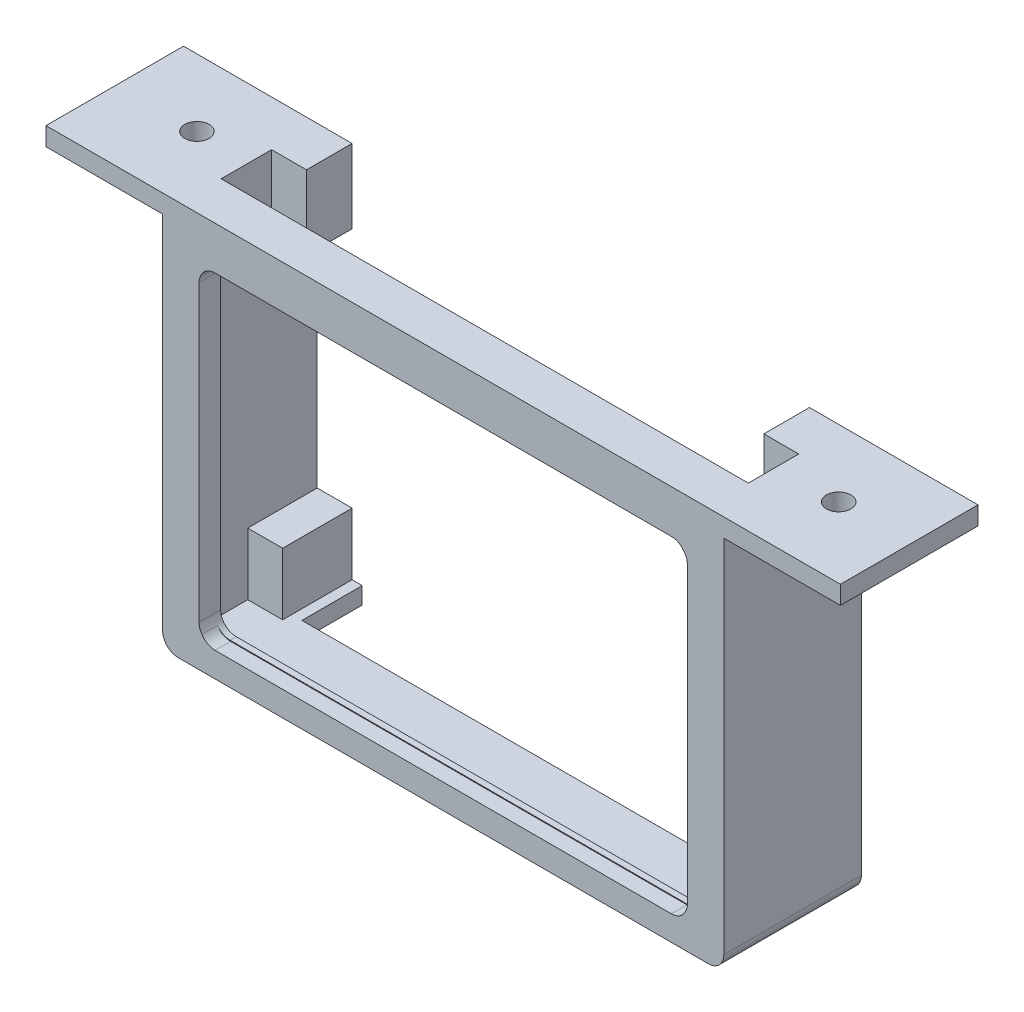
from build123d import *

# Parameters (mm, degrees)
SKETCH1_W            = 91.936945468
SKETCH1_H            = 61.663418702
SKETCH1_W_2          = 86.36
SKETCH1_H_2          = 56.134
BOSS_EXTRUDE1_DEPTH  = 20
SKETCH2_W            = 86.36
SKETCH2_H            = 56.134
BOSS_EXTRUDE3_DEPTH  = 1
SKETCH4_W            = 80
SKETCH4_H            = 53.28
CUT_EXTRUDE6_DEPTH   = 59.853162931
SKETCH5_W            = 155.947075919
SKETCH5_H            = 20
BOSS_EXTRUDE4_DEPTH  = 3
SKETCH8_W            = 12.917881336
SKETCH8_H            = 3
CUT_EXTRUDE7_DEPTH   = 88.335862802
SKETCH9_W            = 12.878183793
SKETCH9_H            = 3
CUT_EXTRUDE8_DEPTH   = 88.300413605
SKETCH10_R           = 2
CUT_EXTRUDE9_DEPTH   = 94.894510599
SKETCH10_3_R         = 2
CUT_EXTRUDE10_DEPTH  = 94.894510599
SKETCH11_W           = 74.933585118
SKETCH11_H           = 15.731166257
CUT_EXTRUDE11_DEPTH  = 20
FILLET1_R            = 2.54
FILLET2_R            = 2.54
FILLET3_R            = 2.54
FILLET4_R            = 2.54
FILLET5_R            = 2.54
FILLET6_R            = 2.54
SKETCH14_W           = 5.713207441
SKETCH14_H           = 8.255
CUT_EXTRUDE12_DEPTH  = 91.021549452
SKETCH15_W           = 5.713207441
SKETCH15_H           = 8.255
CUT_EXTRUDE13_DEPTH  = 91.021549452
SKETCH16_W           = 7.476166257
SKETCH16_H           = 6.35
BOSS_EXTRUDE5_DEPTH  = 5.713207
SKETCH17_W           = 7.476166257
SKETCH17_H           = 6.35
BOSS_EXTRUDE6_DEPTH  = 5.713207441
SKETCH18_W           = 11.38
SKETCH18_H           = 10.16
BOSS_EXTRUDE7_DEPTH  = 5.713207441
SKETCH19_W           = 11.38
SKETCH19_H           = 10.16
BOSS_EXTRUDE8_DEPTH  = 5.713207441
SKETCH20_W           = 71.616945468
SKETCH20_H           = 9.886340198
CUT_EXTRUDE14_DEPTH  = 94.894510599
SKETCH23_W           = 130.15101079
SKETCH23_H           = 3
BOSS_EXTRUDE14_DEPTH = 2.54


with BuildPart() as part:
    # Sketch1 → Boss-Extrude1 (new body)
    with BuildSketch(Plane.XY):
        Rectangle(SKETCH1_W, SKETCH1_H)
        Rectangle(SKETCH1_W_2, SKETCH1_H_2, mode=Mode.SUBTRACT)
    extrude(amount=BOSS_EXTRUDE1_DEPTH)

    # Sketch2 → Boss-Extrude3 (add)
    with BuildSketch(Plane.XY.offset(20)):
        Rectangle(SKETCH2_W, SKETCH2_H)
    extrude(amount=-BOSS_EXTRUDE3_DEPTH)

    # Sketch4 → Cut-Extrude6 (cut, through all)
    with BuildSketch(Plane.XY.offset(20)):
        Rectangle(SKETCH4_W, SKETCH4_H)
    extrude(amount=-CUT_EXTRUDE6_DEPTH, mode=Mode.SUBTRACT)

    # Sketch5 → Boss-Extrude4 (add)
    with BuildSketch(Plane(origin=(0, 30.831709351, 0), x_dir=(1, 0, 0), z_dir=(0, 1, 0))):
        with Locations((0.019848772, -10)):
            Rectangle(SKETCH5_W, SKETCH5_H)
    extrude(amount=BOSS_EXTRUDE4_DEPTH)

    # Sketch8 → Cut-Extrude7 (cut, through all)
    with BuildSketch(Plane.XY.offset(20)):
        with Locations((71.534446063, 32.331709351)):
            Rectangle(SKETCH8_W, SKETCH8_H)
    extrude(amount=-CUT_EXTRUDE7_DEPTH, mode=Mode.SUBTRACT)

    # Sketch9 → Cut-Extrude8 (cut, through all)
    with BuildSketch(Plane.XY.offset(20)):
        with Locations((-71.514597291, 32.331709351)):
            Rectangle(SKETCH9_W, SKETCH9_H)
    extrude(amount=-CUT_EXTRUDE8_DEPTH, mode=Mode.SUBTRACT)

    # Sketch10 → Cut-Extrude9 (cut, through all)
    with BuildSketch(Plane(origin=(0, 33.831709351, 0), x_dir=(1, 0, 0), z_dir=(0, 1, 0))):
        with Locations(Location((53.249133704, -11, 0), (0, 0, 270))):
            Circle(SKETCH10_R)
    extrude(amount=-CUT_EXTRUDE9_DEPTH, mode=Mode.SUBTRACT)

    # Sketch10<3> → Cut-Extrude10 (cut, through all)
    with BuildSketch(Plane(origin=(0, 33.831709351, 0), x_dir=(1, 0, 0), z_dir=(0, 1, 0))):
        with Locations(Location((53.249133704, -11, 0), (0, 0, 270))):
            Circle(SKETCH10_3_R)
        with Locations(Location((-51.881510593, -11, 0), (0, 0, 270))):
            Circle(SKETCH10_3_R)
    extrude(amount=-CUT_EXTRUDE10_DEPTH, mode=Mode.SUBTRACT)

    # Sketch11 → Cut-Extrude11 (cut)
    with BuildSketch(Plane(origin=(0, 33.831709351, 0), x_dir=(1, 0, 0), z_dir=(0, 1, 0))):
        with Locations((0, -7.865583129)):
            Rectangle(SKETCH11_W, SKETCH11_H)
    extrude(amount=-CUT_EXTRUDE11_DEPTH, mode=Mode.SUBTRACT)

    # Fillet1
    fillet1_edges = [part.edges().sort_by_distance(p)[0] for p in [
        (40, 26.64, 19.5),
    ]]
    fillet(fillet1_edges, radius=FILLET1_R)

    # Fillet2
    fillet2_edges = [part.edges().sort_by_distance(p)[0] for p in [
        (-40, 26.64, 19.5),
    ]]
    fillet(fillet2_edges, radius=FILLET2_R)

    # Fillet3
    fillet3_edges = [part.edges().sort_by_distance(p)[0] for p in [
        (-40, -26.64, 19.5),
    ]]
    fillet(fillet3_edges, radius=FILLET3_R)

    # Fillet4
    fillet4_edges = [part.edges().sort_by_distance(p)[0] for p in [
        (40, -26.64, 19.5),
    ]]
    fillet(fillet4_edges, radius=FILLET4_R)

    # Fillet5
    fillet5_edges = [part.edges().sort_by_distance(p)[0] for p in [
        (-45.968472734, -30.831709351, 10),
    ]]
    fillet(fillet5_edges, radius=FILLET5_R)

    # Fillet6
    fillet6_edges = [part.edges().sort_by_distance(p)[0] for p in [
        (45.968472734, -30.831709351, 10),
    ]]
    fillet(fillet6_edges, radius=FILLET6_R)

    # Sketch14 → Cut-Extrude12 (cut, through all)
    with BuildSketch(Plane.XZ.offset(-28.067)):
        with Locations((40.32339628, 11.603666257)):
            Rectangle(SKETCH14_W, SKETCH14_H)
    extrude(amount=-CUT_EXTRUDE12_DEPTH, mode=Mode.SUBTRACT)

    # Sketch15 → Cut-Extrude13 (cut, through all)
    with BuildSketch(Plane.XZ.offset(-28.067)):
        with Locations((-40.32339628, 11.603666257)):
            Rectangle(SKETCH15_W, SKETCH15_H)
    extrude(amount=-CUT_EXTRUDE13_DEPTH, mode=Mode.SUBTRACT)

    # Sketch16 → Boss-Extrude5 (add)
    with BuildSketch(Plane.ZY.offset(-43.18)):
        with Locations((3.738083129, 24.892)):
            Rectangle(SKETCH16_W, SKETCH16_H)
    extrude(amount=BOSS_EXTRUDE5_DEPTH)

    # Sketch17 → Boss-Extrude6 (add)
    with BuildSketch(Plane(origin=(-43.18, 0, 0), x_dir=(0, 0, -1), z_dir=(1, 0, 0))):
        with Locations((-3.738083129, 24.892)):
            Rectangle(SKETCH17_W, SKETCH17_H)
    extrude(amount=BOSS_EXTRUDE6_DEPTH)

    # Sketch18 → Boss-Extrude7 (add)
    with BuildSketch(Plane(origin=(-43.18, 0, 0), x_dir=(0, 0, -1), z_dir=(1, 0, 0))):
        with Locations((-5.69, -22.987)):
            Rectangle(SKETCH18_W, SKETCH18_H)
    extrude(amount=BOSS_EXTRUDE7_DEPTH)

    # Sketch19 → Boss-Extrude8 (add)
    with BuildSketch(Plane.ZY.offset(-43.18)):
        with Locations((5.69, -22.987)):
            Rectangle(SKETCH19_W, SKETCH19_H)
    extrude(amount=BOSS_EXTRUDE8_DEPTH)

    # Sketch20 → Cut-Extrude14 (cut, through all)
    with BuildSketch(Plane.XZ.offset(30.831709351)):
        with Locations((0, 4.943170099)):
            Rectangle(SKETCH20_W, SKETCH20_H)
    extrude(amount=-CUT_EXTRUDE14_DEPTH, mode=Mode.SUBTRACT)

    # Sketch23 → Boss-Extrude14 (add)
    # profile 1 of 2: a face of its own
    with BuildSketch(Plane.XY.offset(20)):
        with BuildLine():
            Line((-43.428472734, -30.831709351), (43.428472734, -30.831709351))
            ThreePointArc((43.428472734, -30.831709351), (45.224523958, -30.087760575), (45.968472734, -28.291709351))
            Line((45.968472734, -28.291709351), (45.968472734, 30.831709351))
            Line((45.968472734, 30.831709351), (-45.968472734, 30.831709351))
            Line((-45.968472734, 30.831709351), (-45.968472734, -28.291709351))
            ThreePointArc((-45.968472734, -28.291709351), (-45.224523958, -30.087760575), (-43.428472734, -30.831709351))
        make_face()
        with BuildLine():
            ThreePointArc((39.537823304, -25.560907361), (38.61351341, -26.44781055), (37.373915264, -26.770831426))
            Line((37.373915264, -26.770831426), (-37.373915264, -26.770831426))
            ThreePointArc((-37.373915264, -26.770831426), (-38.61351341, -26.44781055), (-39.537823304, -25.560907361))
            ThreePointArc((-39.537823304, -25.560907361), (-39.881700972, -24.866136022), (-40, -24.1))
            Line((-40, -24.1), (-40, 24.1))
            ThreePointArc((-40, 24.1), (-39.881700972, 24.866136022), (-39.537823304, 25.560907361))
            ThreePointArc((-39.537823304, 25.560907361), (-38.61351341, 26.44781055), (-37.373915264, 26.770831426))
            Line((-37.373915264, 26.770831426), (37.373915264, 26.770831426))
            ThreePointArc((37.373915264, 26.770831426), (38.61351341, 26.44781055), (39.537823304, 25.560907361))
            ThreePointArc((39.537823304, 25.560907361), (39.881700972, 24.866136022), (40, 24.1))
            Line((40, 24.1), (40, -24.1))
            ThreePointArc((40, -24.1), (39.881700972, -24.866136022), (39.537823304, -25.560907361))
        make_face(mode=Mode.SUBTRACT)
    # profile 2 of 2: a face of its own
    with BuildSketch(Plane.XY.offset(20)):
        with Locations((0, 32.331709351)):
            Rectangle(SKETCH23_W, SKETCH23_H)
    extrude(amount=BOSS_EXTRUDE14_DEPTH)


solid = part.part
